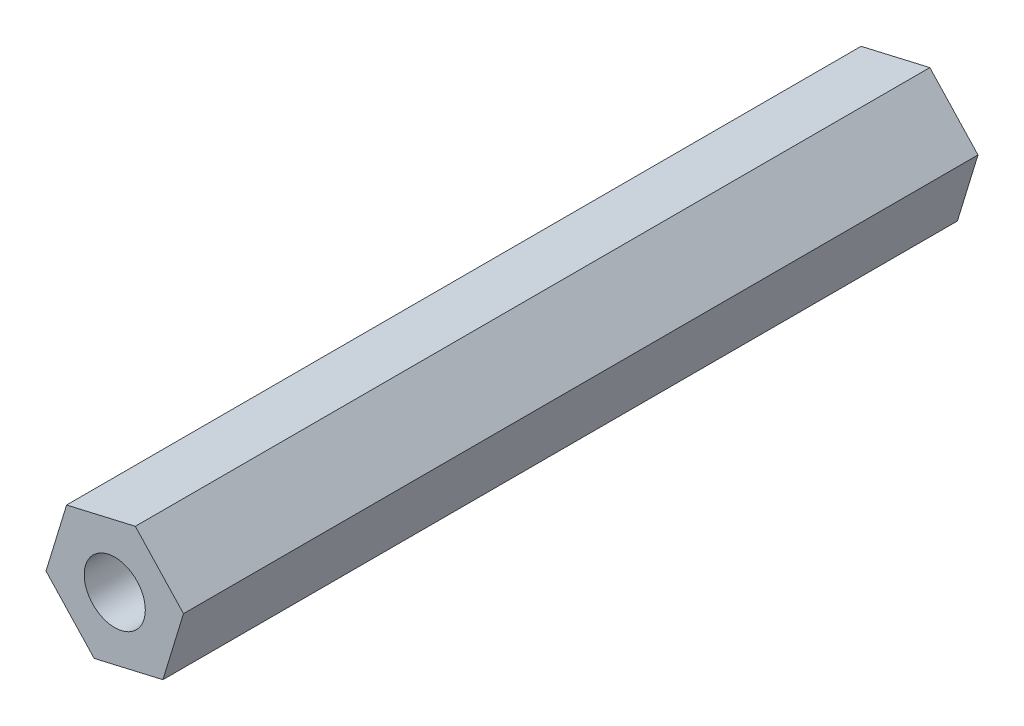
from build123d import *

# Parameters (mm, degrees)
BOSS_EXTRUDE1_DEPTH = 82.55
SKETCH2_R           = 3.175
CUT_EXTRUDE1_DEPTH  = 127


with BuildPart() as part:
    # Sketch1 → Boss-Extrude1 (new body)
    with BuildSketch(Plane.XY):
        Polygon((5.004311653, -5.359122896), (7.143292396, 1.654299572), (2.138980743, 7.013422468), (-5.004311653, 5.359122896), (-7.143292396, -1.654299572), (-2.138980743, -7.013422468), align=None)
    extrude(amount=BOSS_EXTRUDE1_DEPTH)

    # Sketch2 → Cut-Extrude1 (cut)
    with BuildSketch(Plane.XY.offset(82.55)):
        Circle(SKETCH2_R)
    extrude(amount=-CUT_EXTRUDE1_DEPTH, mode=Mode.SUBTRACT)


solid = part.part
